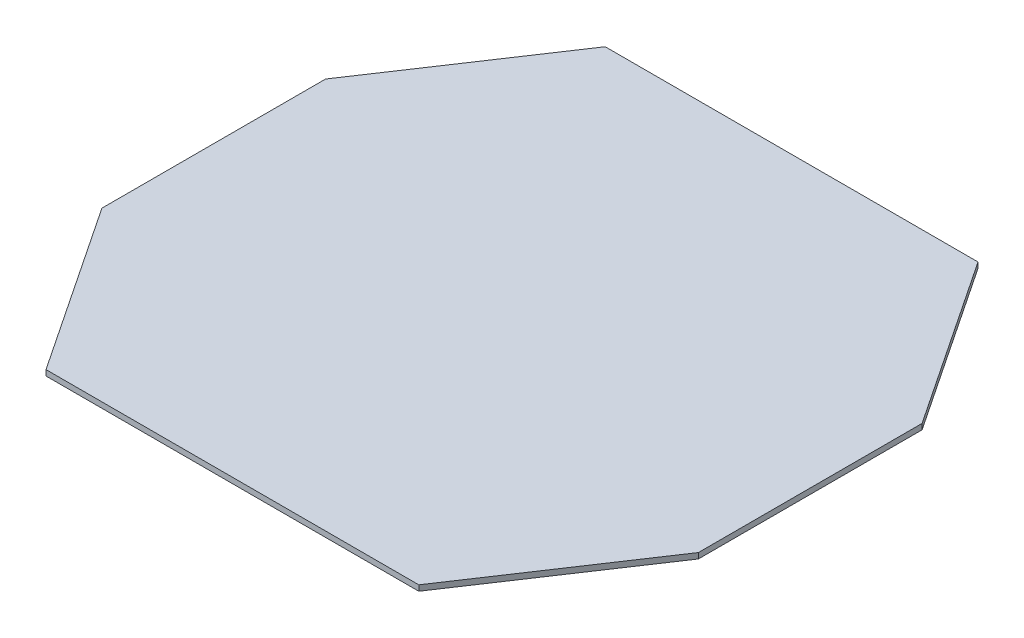
from build123d import *

# Parameters (mm, degrees)
BOSS_EXTRUDE1_DEPTH = 3


with BuildPart() as part:
    # Sketch2 → Boss-Extrude1 (new body)
    with BuildSketch(Plane(origin=(0, 0, 0), x_dir=(1, 0, 0), z_dir=(0, 1, 0))):
        Polygon((-100, 150), (100, 150), (160, 60), (160, -60), (100, -150), (-100, -150), (-160, -60), (-160, 60), align=None)
    extrude(amount=BOSS_EXTRUDE1_DEPTH)


solid = part.part
